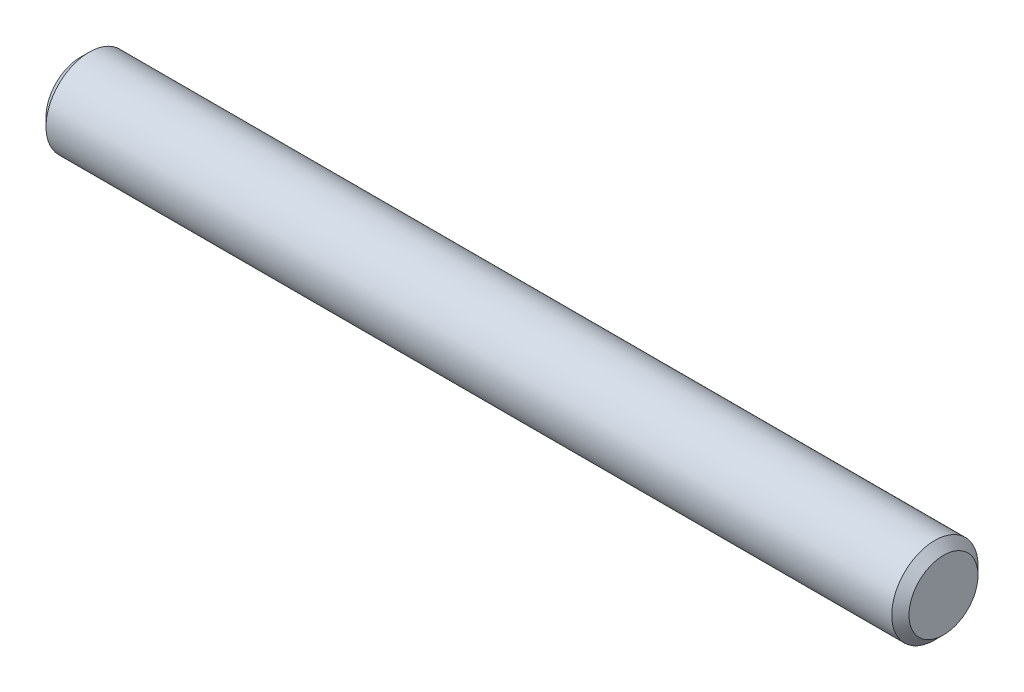
from build123d import *

# Parameters (mm, degrees)
EXTRUDE1_DEPTH      = 3.96875
EXTRUDE1_DEPTH_BACK = 3.96875
SKETCH2_R           = 0.396875
CHAMFER1_SIZE       = 0.079375


with BuildPart() as part:
    # Sketch2 → Extrude1 (new, two sides: drawn at the far end of the back side and taken through both)
    with BuildSketch(Plane(origin=(0, 0, 0), x_dir=(0, 0, -1), z_dir=(1, 0, 0)).offset(-EXTRUDE1_DEPTH_BACK)):
        Circle(SKETCH2_R)
    extrude(amount=EXTRUDE1_DEPTH + EXTRUDE1_DEPTH_BACK)

    # Chamfer1
    chamfer1_edges = [part.edges().sort_by_distance(p)[0] for p in [
        (-3.96875, 0, 0.396875),
        (3.96875, 0, 0.396875),
    ]]
    chamfer(chamfer1_edges, length=CHAMFER1_SIZE)


solid = part.part
